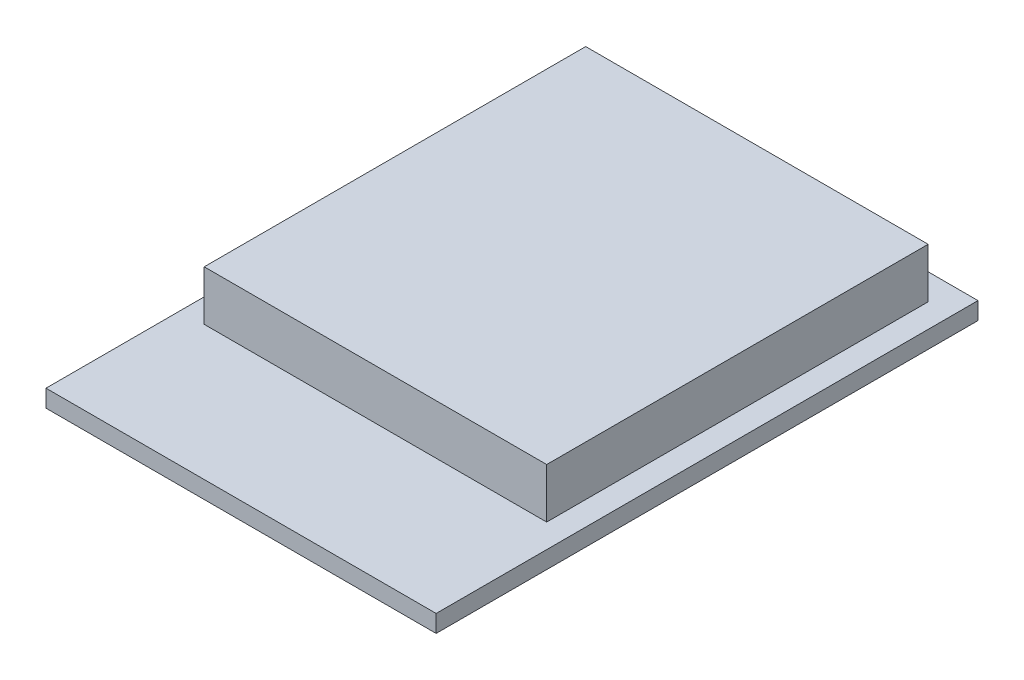
from build123d import *

# Parameters (mm, degrees)
SKETCH1_W      = 18
SKETCH1_H      = 25
EXTRUDE1_DEPTH = 0.8
SKETCH2_W      = 15.8
SKETCH2_H      = 17.6
EXTRUDE2_DEPTH = 2.3


with BuildPart() as part:
    # Sketch1 → Extrude1 (new body)
    with BuildSketch(Plane(origin=(0, 0, 0), x_dir=(1, 0, 0), z_dir=(0, 1, 0))):
        Rectangle(SKETCH1_W, SKETCH1_H)
    extrude(amount=EXTRUDE1_DEPTH)

    # Sketch2 → Extrude2 (add)
    with BuildSketch(Plane(origin=(0, 0.8, 0), x_dir=(-1, 0, 0), z_dir=(0, 1, 0))):
        with Locations((0, -2.5)):
            Rectangle(SKETCH2_W, SKETCH2_H)
    extrude(amount=EXTRUDE2_DEPTH)


solid = part.part
